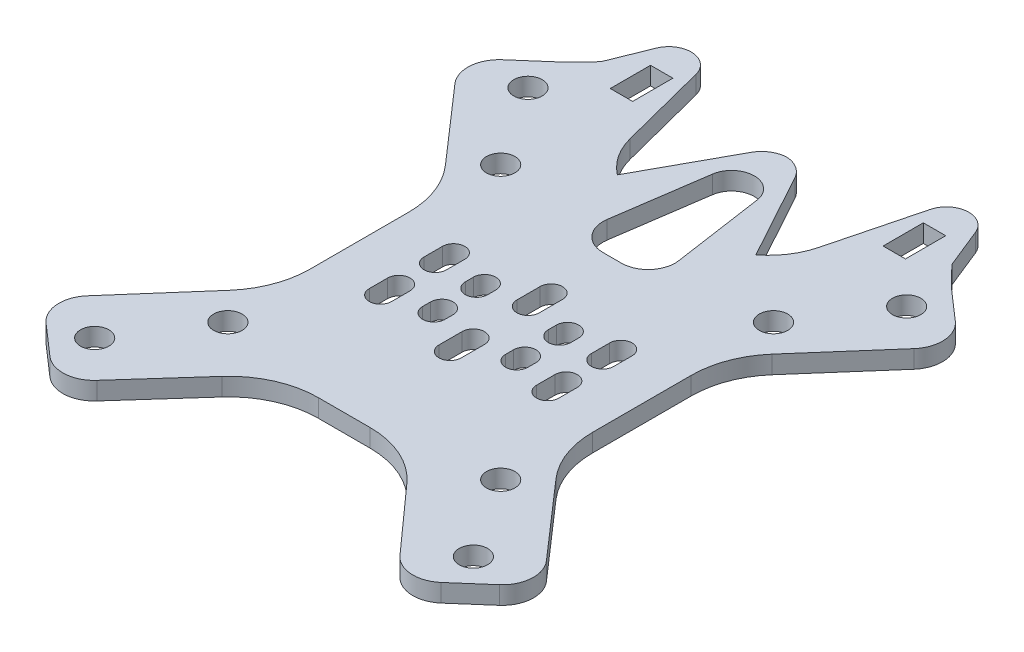
from build123d import *

# Parameters (mm, degrees)
CROQUIS2_R              = 1.5875
CROQUIS2_R_2            = 1.59
CROQUIS2_W              = 2.5
CROQUIS2_H              = 4.5
SALIENTE_EXTRUIR1_DEPTH = 2


with BuildPart() as part:
    # Croquis2 → Saliente-Extruir1 (new body)
    with BuildSketch(Plane(origin=(0, 0, 0), x_dir=(1, 0, 0), z_dir=(0, 1, 0))):
        with BuildLine():
            ThreePointArc((-15.794895255, -5.504961381), (-16.432835447, -9.019479294), (-18.265262487, -12.08558676))
            Line((-18.265262487, -12.08558676), (-25.665833323, -20.55341124))
            ThreePointArc((-25.665833323, -20.55341124), (-26.522572581, -23.091497469), (-25.333680736, -25.492001591))
            Line((-25.333680736, -25.492001591), (-21.870049663, -28.519089265))
            ThreePointArc((-21.870049663, -28.519089265), (-19.331963434, -29.375828523), (-16.931459311, -28.186936679))
            Line((-16.931459311, -28.186936679), (-10.339710555, -20.824046432))
            ThreePointArc((-10.339710555, -20.824046432), (-6.969614061, -18.364525857), (-2.889258582, -17.494186265))
            Line((-2.889258582, -17.494186265), (2.889258582, -17.494186265))
            ThreePointArc((2.889258582, -17.494186265), (6.969614061, -18.364525857), (10.339710555, -20.824046432))
            Line((10.339710555, -20.824046432), (16.931459311, -28.186936679))
            ThreePointArc((16.931459311, -28.186936679), (19.331963434, -29.375828523), (21.870049663, -28.519089265))
            Line((21.870049663, -28.519089265), (25.333680736, -25.492001591))
            ThreePointArc((25.333680736, -25.492001591), (26.522572581, -23.091497469), (25.665833323, -20.55341124))
            Line((25.665833323, -20.55341124), (18.265262487, -12.08558676))
            ThreePointArc((18.265262487, -12.08558676), (16.432835447, -9.019479294), (15.794895255, -5.504961381))
            Line((15.794895255, -5.504961381), (15.794895255, 5.504961381))
            ThreePointArc((15.794895255, 5.504961381), (16.432835447, 9.019479294), (18.265262487, 12.08558676))
            Line((18.265262487, 12.08558676), (25.665833323, 20.55341124))
            ThreePointArc((25.665833323, 20.55341124), (26.522572581, 23.091497469), (25.333680736, 25.492001591))
            Line((25.333680736, 25.492001591), (21.870049663, 28.519089265))
            Line((21.870049663, 28.519089265), (19.624131665, 30.812041893))
            Line((19.624131665, 30.812041893), (17.831541391, 35.250897727))
            ThreePointArc((17.831541391, 35.250897727), (15.348771565, 36.809322612), (13.092386176, 34.938077274))
            Line((13.092386176, 34.938077274), (10.747335089, 25.829720308))
            Line((10.747335089, 25.829720308), (10.537909559, 25.016295609))
            ThreePointArc((10.537909559, 25.016295609), (9.494618305, 22.668322934), (7.742465325, 20.789123037))
            Line((7.742465325, 20.789123037), (2.462782312, 30.427383086))
            ThreePointArc((2.462782312, 30.427383086), (1.432591067, 31.523244144), (0, 31.981379817))
            ThreePointArc((0, 31.981379817), (-1.432591067, 31.523244144), (-2.462782312, 30.427383086))
            Line((-2.462782312, 30.427383086), (-7.742465325, 20.789123037))
            ThreePointArc((-7.742465325, 20.789123037), (-9.494618305, 22.668322934), (-10.537909559, 25.016295609))
            Line((-10.537909559, 25.016295609), (-13.092386176, 34.938077274))
            ThreePointArc((-13.092386176, 34.938077274), (-15.348771565, 36.809322612), (-17.831541391, 35.250897727))
            Line((-17.831541391, 35.250897727), (-19.624131665, 30.812041893))
            Line((-19.624131665, 30.812041893), (-21.870049663, 28.519089265))
            Line((-21.870049663, 28.519089265), (-23.601865199, 27.005545428))
            Line((-23.601865199, 27.005545428), (-25.333680736, 25.492001591))
            ThreePointArc((-25.333680736, 25.492001591), (-26.522572581, 23.091497469), (-25.665833323, 20.55341124))
            Line((-25.665833323, 20.55341124), (-18.265262487, 12.08558676))
            ThreePointArc((-18.265262487, 12.08558676), (-16.432835447, 9.019479294), (-15.794895255, 5.504961381))
            Line((-15.794895255, 5.504961381), (-15.794895255, -5.504961381))
        make_face()
        with Locations(Location((-21.166889821, -24.21941655, 0), (0, 0, 270))):
            Circle(CROQUIS2_R, mode=Mode.SUBTRACT)
        with Locations(Location((-15.25, -15.25, 0), (0, 0, 270))):
            Circle(CROQUIS2_R_2, mode=Mode.SUBTRACT)
        with BuildLine():
            Line((-8.099892262, -2.037172726), (-8.099892262, -4.090589628))
            ThreePointArc((-8.099892262, -4.090589628), (-9.349892262, -5.340589628), (-10.599892262, -4.090589628))
            Line((-10.599892262, -4.090589628), (-10.599892262, -2.037172726))
            ThreePointArc((-10.599892262, -2.037172726), (-9.349892262, -0.787172726), (-8.099892262, -2.037172726))
        make_face(mode=Mode.SUBTRACT)
        with BuildLine():
            ThreePointArc((-10.599892262, 4.090589628), (-9.349892262, 5.340589628), (-8.099892262, 4.090589628))
            Line((-8.099892262, 4.090589628), (-8.099892262, 2.037172726))
            ThreePointArc((-8.099892262, 2.037172726), (-9.349892262, 0.787172726), (-10.599892262, 2.037172726))
            Line((-10.599892262, 2.037172726), (-10.599892262, 4.090589628))
        make_face(mode=Mode.SUBTRACT)
        with BuildLine():
            Line((-3.387203965, -1.942277199), (-3.387203965, -2.839990658))
            ThreePointArc((-3.387203965, -2.839990658), (-4.637203965, -4.089990658), (-5.887203965, -2.839990658))
            Line((-5.887203965, -2.839990658), (-5.887203965, -1.942277199))
            ThreePointArc((-5.887203965, -1.942277199), (-4.637203965, -0.692277199), (-3.387203965, -1.942277199))
        make_face(mode=Mode.SUBTRACT)
        with BuildLine():
            ThreePointArc((-5.887203965, 2.839990658), (-4.637203965, 4.089990658), (-3.387203965, 2.839990658))
            Line((-3.387203965, 2.839990658), (-3.387203965, 1.942277199))
            ThreePointArc((-3.387203965, 1.942277199), (-4.637203965, 0.692277199), (-5.887203965, 1.942277199))
            Line((-5.887203965, 1.942277199), (-5.887203965, 2.839990658))
        make_face(mode=Mode.SUBTRACT)
        with Locations(Location((21.166889821, -24.21941655, 0), (0, 0, 270))):
            Circle(CROQUIS2_R, mode=Mode.SUBTRACT)
        with Locations(Location((15.25, -15.25, 0), (0, 0, 270))):
            Circle(CROQUIS2_R_2, mode=Mode.SUBTRACT)
        with BuildLine():
            ThreePointArc((1.25, -5.653716791), (0, -6.903716791), (-1.25, -5.653716791))
            Line((-1.25, -5.653716791), (-1.25, -3.063881177))
            ThreePointArc((-1.25, -3.063881177), (0, -1.813881177), (1.25, -3.063881177))
            Line((1.25, -3.063881177), (1.25, -5.653716791))
        make_face(mode=Mode.SUBTRACT)
        with BuildLine():
            ThreePointArc((5.887203965, -2.839990658), (4.637203965, -4.089990658), (3.387203965, -2.839990658))
            Line((3.387203965, -2.839990658), (3.387203965, -1.942277199))
            ThreePointArc((3.387203965, -1.942277199), (4.637203965, -0.692277199), (5.887203965, -1.942277199))
            Line((5.887203965, -1.942277199), (5.887203965, -2.839990658))
        make_face(mode=Mode.SUBTRACT)
        with BuildLine():
            Line((3.387203965, 1.942277199), (3.387203965, 2.839990658))
            ThreePointArc((3.387203965, 2.839990658), (4.637203965, 4.089990658), (5.887203965, 2.839990658))
            Line((5.887203965, 2.839990658), (5.887203965, 1.942277199))
            ThreePointArc((5.887203965, 1.942277199), (4.637203965, 0.692277199), (3.387203965, 1.942277199))
        make_face(mode=Mode.SUBTRACT)
        with BuildLine():
            ThreePointArc((10.599892262, -4.090589628), (9.349892262, -5.340589628), (8.099892262, -4.090589628))
            Line((8.099892262, -4.090589628), (8.099892262, -2.037172726))
            ThreePointArc((8.099892262, -2.037172726), (9.349892262, -0.787172726), (10.599892262, -2.037172726))
            Line((10.599892262, -2.037172726), (10.599892262, -4.090589628))
        make_face(mode=Mode.SUBTRACT)
        with BuildLine():
            Line((8.099892262, 2.037172726), (8.099892262, 4.090589628))
            ThreePointArc((8.099892262, 4.090589628), (9.349892262, 5.340589628), (10.599892262, 4.090589628))
            Line((10.599892262, 4.090589628), (10.599892262, 2.037172726))
            ThreePointArc((10.599892262, 2.037172726), (9.349892262, 0.787172726), (8.099892262, 2.037172726))
        make_face(mode=Mode.SUBTRACT)
        with Locations(Location((-15.25, 15.25, 0), (0, 0, 270))):
            Circle(CROQUIS2_R_2, mode=Mode.SUBTRACT)
        with BuildLine():
            ThreePointArc((-19.579389821, 24.21941655), (-21.823295119, 22.773979477), (-22.211564099, 25.414745752))
            ThreePointArc((-22.211564099, 25.414745752), (-20.510484522, 25.664853624), (-19.579389821, 24.21941655))
        make_face(mode=Mode.SUBTRACT)
        with Locations((-15.25, 31.000541934)):
            Rectangle(CROQUIS2_W, CROQUIS2_H, mode=Mode.SUBTRACT)
        with BuildLine():
            Line((-1.25, 3.063881177), (-1.25, 5.653716791))
            ThreePointArc((-1.25, 5.653716791), (0, 6.903716791), (1.25, 5.653716791))
            Line((1.25, 5.653716791), (1.25, 3.063881177))
            ThreePointArc((1.25, 3.063881177), (0, 1.813881177), (-1.25, 3.063881177))
        make_face(mode=Mode.SUBTRACT)
        with Locations(Location((15.25, 15.25, 0), (0, 0, 270))):
            Circle(CROQUIS2_R_2, mode=Mode.SUBTRACT)
        with BuildLine():
            ThreePointArc((3.999695887, 15.899705615), (3.300253998, 13.504573342), (1.031076217, 12.466927083))
            Line((1.031076217, 12.466927083), (-1.031076217, 12.466927083))
            ThreePointArc((-1.031076217, 12.466927083), (-3.300253998, 13.504573342), (-3.999695887, 15.899705615))
            Line((-3.999695887, 15.899705615), (-2.500174028, 26.185590314))
            ThreePointArc((-2.500174028, 26.185590314), (0, 28.347706433), (2.500174028, 26.185590314))
            Line((2.500174028, 26.185590314), (3.999695887, 15.899705615))
        make_face(mode=Mode.SUBTRACT)
        with Locations(Location((21.166889821, 24.21941655, 0), (0, 0, 270))):
            Circle(CROQUIS2_R, mode=Mode.SUBTRACT)
        with Locations((15.25, 31.000541934)):
            Rectangle(CROQUIS2_W, CROQUIS2_H, mode=Mode.SUBTRACT)
    extrude(amount=SALIENTE_EXTRUIR1_DEPTH)


solid = part.part
